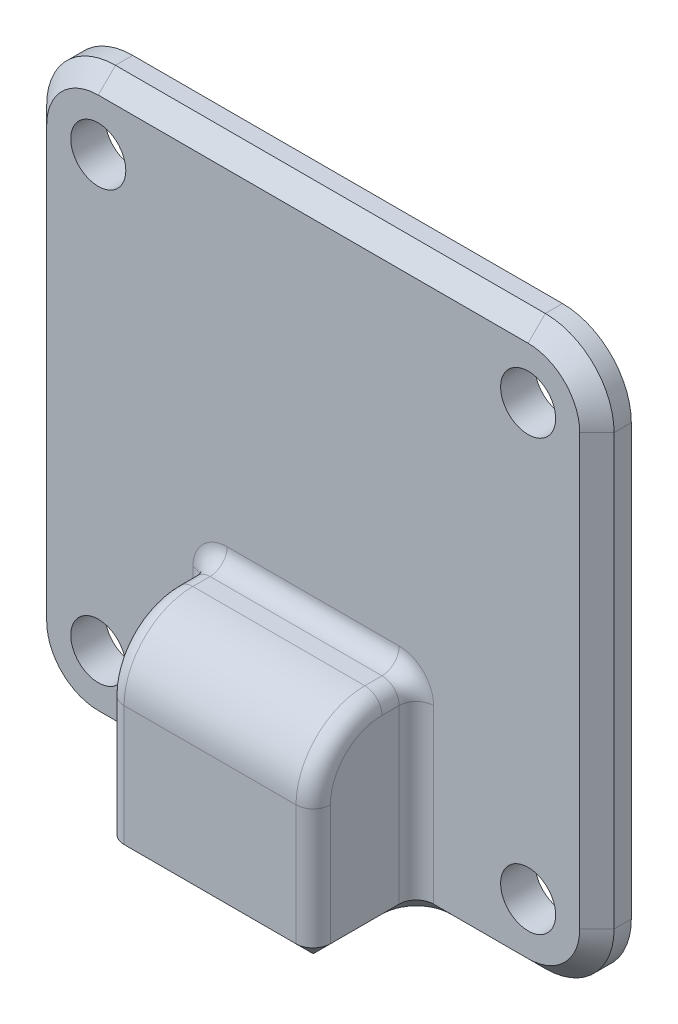
from build123d import *

# Parameters (mm, degrees)
SKETCH1_R               = 1.6
BOSS_EXTRUDE1_DEPTH     = 2
SKETCH2_W               = 12
SKETCH2_H               = 12
BOSS_EXTRUDE2_DEPTH     = 6
CUT_EXTRUDE1_DEPTH      = 4
CUT_EXTRUDE1_DEPTH_BACK = 25.093567606
SKETCH2_3_W             = 8
SKETCH2_3_H             = 10
FILLET1_R               = 4
FILLET3_R               = 1
CHAMFER1_SIZE           = 1


with BuildPart() as part:
    # Sketch1 → Boss-Extrude1 (new body)
    with BuildSketch(Plane.XY):
        with BuildLine():
            Line((-12.5, -16.5), (12.5, -16.5))
            ThreePointArc((12.5, -16.5), (15.328427125, -15.328427125), (16.5, -12.5))
            Line((16.5, -12.5), (16.5, 12.5))
            ThreePointArc((16.5, 12.5), (15.328427125, 15.328427125), (12.5, 16.5))
            Line((12.5, 16.5), (-12.5, 16.5))
            ThreePointArc((-12.5, 16.5), (-15.328427125, 15.328427125), (-16.5, 12.5))
            Line((-16.5, 12.5), (-16.5, -12.5))
            ThreePointArc((-16.5, -12.5), (-15.328427125, -15.328427125), (-12.5, -16.5))
        make_face()
        with Locations((-12.5, -12.5)):
            Circle(SKETCH1_R, mode=Mode.SUBTRACT)
        with Locations((12.5, -12.5)):
            Circle(SKETCH1_R, mode=Mode.SUBTRACT)
        with Locations((12.5, 12.5)):
            Circle(SKETCH1_R, mode=Mode.SUBTRACT)
        with Locations((-12.5, 12.5)):
            Circle(SKETCH1_R, mode=Mode.SUBTRACT)
    extrude(amount=BOSS_EXTRUDE1_DEPTH)

    # Sketch2 → Boss-Extrude2 (add)
    with BuildSketch(Plane.XY.offset(2)):
        with Locations((0, -10.5)):
            Rectangle(SKETCH2_W, SKETCH2_H)
    extrude(amount=BOSS_EXTRUDE2_DEPTH)

    # Sketch2<3> → Cut-Extrude1 (cut, two sides: drawn at the far end of the back side and taken through both)
    with BuildSketch(Plane.XY.offset(2).offset(-CUT_EXTRUDE1_DEPTH_BACK)):
        with Locations((0, -11.5)):
            Rectangle(SKETCH2_3_W, SKETCH2_3_H)
    extrude(amount=CUT_EXTRUDE1_DEPTH + CUT_EXTRUDE1_DEPTH_BACK, mode=Mode.SUBTRACT)

    # Fillet1
    fillet1_edges = [part.edges().sort_by_distance(p)[0] for p in [
        (0, -4.5, 8),
    ]]
    fillet(fillet1_edges, radius=FILLET1_R)

    # Fillet3
    fillet3_edges = [part.edges().sort_by_distance(p)[0] for p in [
        (-6, -12.5, 8),
        (-6, -10.5, 2),
        (0, -4.5, 2),
        (6, -10.5, 2),
        (-6, -4.5, 3),
        (6, -4.5, 3),
        (6, -12.5, 8),
        (6, -5.671572875, 6.828427125),
        (-6, -5.671572875, 6.828427125),
    ]]
    fillet(fillet3_edges, radius=FILLET3_R)

    # Chamfer1
    chamfer1_edges = [part.edges().sort_by_distance(p)[0] for p in [
        (-15.328427125, -15.328427125, 2),
        (-9.75, -16.5, 2),
        (15.328427125, -15.328427125, 2),
        (16.5, 0, 2),
        (15.328427125, 15.328427125, 2),
        (0, 16.5, 2),
        (-15.328427125, 15.328427125, 2),
        (-6, -16.5, 5),
        (0, -16.5, 8),
        (9.75, -16.5, 2),
        (6, -16.5, 5),
        (5.707106781, -16.5, 7.707106781),
        (-5.707106781, -16.5, 7.707106781),
        (-16.5, 0, 2),
        (-6.292893219, -16.5, 2.292893219),
        (6.292893219, -16.5, 2.292893219),
    ]]
    chamfer(chamfer1_edges, length=CHAMFER1_SIZE)


solid = part.part
